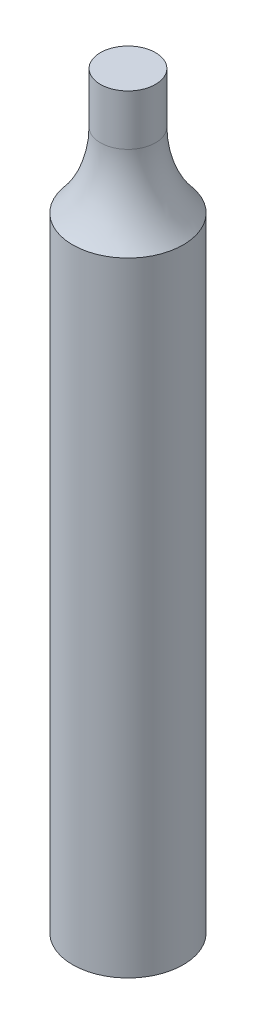
from build123d import *


with BuildPart() as part:
    # Sketch1 → Revolve3 (revolve)
    with BuildSketch(Plane(origin=(0, 0, 0), x_dir=(0, 0, -1), z_dir=(1, 0, 0))):
        with BuildLine():
            Line((-16.287004569, 15.155873034), (-16.287004569, -126.667164195))
            Line((-16.287004569, -126.667164195), (-26.763944238, -126.667164195))
            Line((-26.763944238, -126.667164195), (-26.763944238, -8.54722199))
            ThreePointArc((-26.763944238, -8.54722199), (-22.861453726, -1.96258681), (-21.503653567, 5.570223514))
            Line((-21.503653567, 5.570223514), (-21.503653567, 15.155873034))
            Line((-21.503653567, 15.155873034), (-16.287004569, 15.155873034))
        make_face()
    revolve(axis=Axis((0, 15.155873034, 16.287004569), (0, -1, 0)))


solid = part.part
